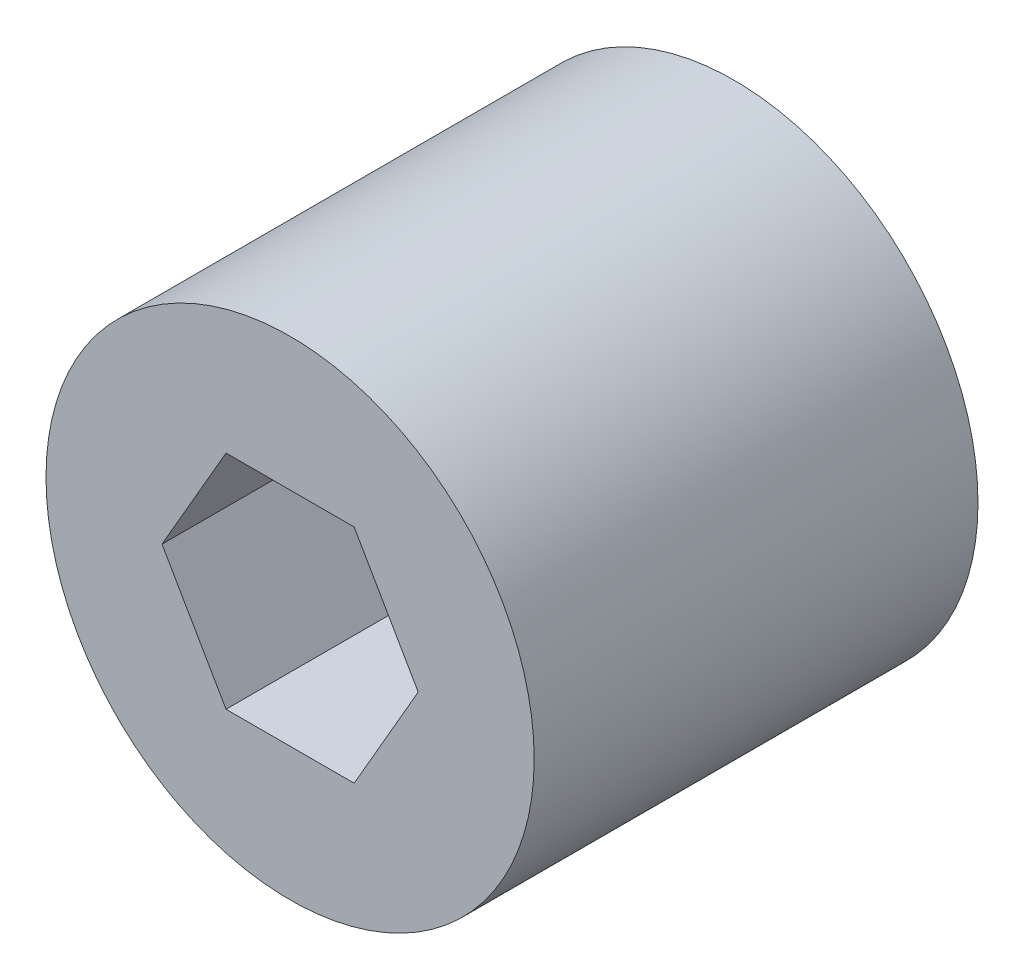
from build123d import *

# Parameters (mm, degrees)
SKETCH2_R           = 13.97
BOSS_EXTRUDE1_DEPTH = 25.4


with BuildPart() as part:
    # Sketch2 → Boss-Extrude1 (new body)
    with BuildSketch(Plane.XY):
        Circle(SKETCH2_R)
        Polygon((-3.666174209, 6.35), (-7.332348419, 0), (-3.666174209, -6.35), (3.666174209, -6.35), (7.332348419, 0), (3.666174209, 6.35), align=None, mode=Mode.SUBTRACT)
    extrude(amount=-BOSS_EXTRUDE1_DEPTH)


solid = part.part
